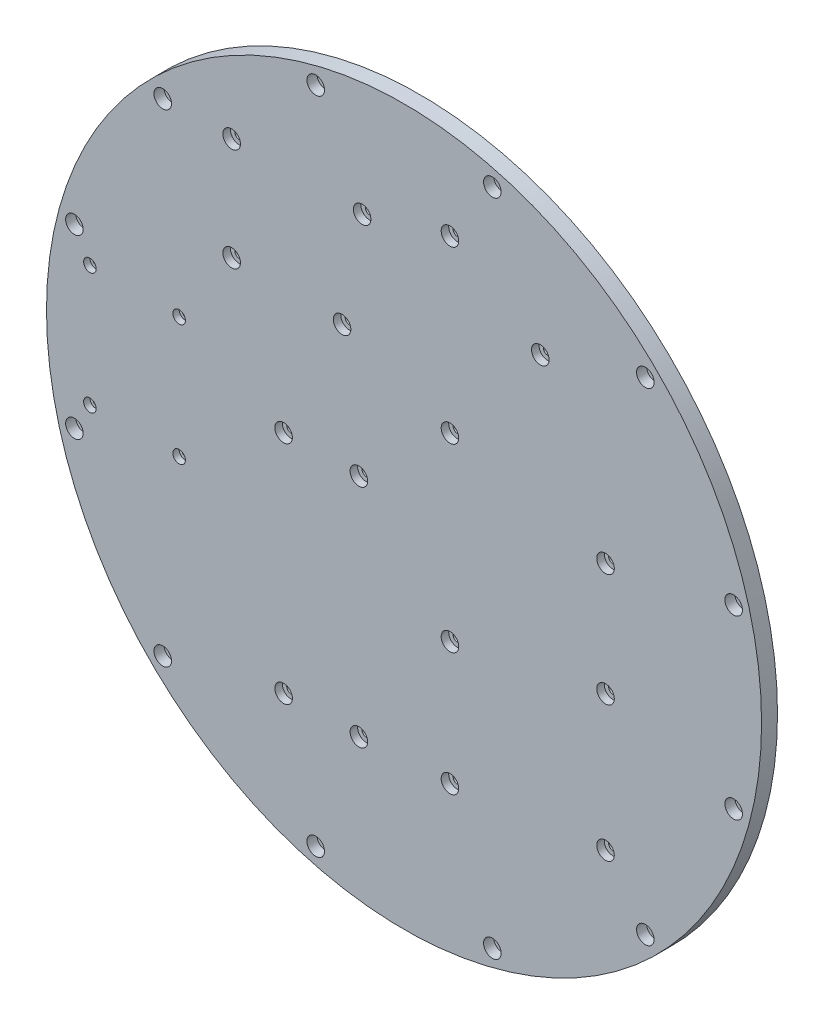
from build123d import *

# Parameters (mm, degrees)
ESQUISSE1_R              = 142.5
ESQUISSE1_R_2            = 1.75
BOSS_EXTRU_1_DEPTH       = 6.35
ESQUISSE2_R              = 3.5
ENL_V_MAT_EXTRU_1_DEPTH  = 4
ENL_V_MAT_EXTRU_2_REACH  = 203.625
ESQUISSE3_R              = 1.25
ESQUISSE4_R              = 2.5
ENL_V_MAT_EXTRU_3_DEPTH  = 2.5
ENL_V_MAT_EXTRU_4_REACH  = 203.625
ESQUISSE5_R              = 1.75
ESQUISSE6_R              = 3.5
ENL_V_MAT_EXTRU_5_DEPTH  = 3
ENL_V_MAT_EXTRU_6_REACH  = 203.625
ESQUISSE7_R              = 1.75
ESQUISSE8_R              = 3.5
ENL_V_MAT_EXTRU_7_DEPTH  = 3
ENL_V_MAT_EXTRU_8_REACH  = 203.625
ESQUISSE9_R              = 1.75
ESQUISSE10_R             = 3.5
ENL_V_MAT_EXTRU_9_DEPTH  = 3
ENL_V_MAT_EXTRU_10_REACH = 203.625
ESQUISSE11_R             = 1.75
ESQUISSE12_R             = 3.5
ENL_V_MAT_EXTRU_11_DEPTH = 3


with BuildPart() as part:
    # Esquisse1 → Boss.-Extru.1 (new body)
    with BuildSketch(Plane.XY):
        Circle(ESQUISSE1_R)
        with Locations((-35.199390134, 131.365912375)):
            Circle(ESQUISSE1_R_2, mode=Mode.SUBTRACT)
        with Locations((35.199390134, 131.365912375)):
            Circle(ESQUISSE1_R_2, mode=Mode.SUBTRACT)
        with Locations((96.166522241, 96.166522241)):
            Circle(ESQUISSE1_R_2, mode=Mode.SUBTRACT)
        with Locations((131.365912375, 35.199390134)):
            Circle(ESQUISSE1_R_2, mode=Mode.SUBTRACT)
        with Locations((131.365912375, -35.199390134)):
            Circle(ESQUISSE1_R_2, mode=Mode.SUBTRACT)
        with Locations((96.166522241, -96.166522241)):
            Circle(ESQUISSE1_R_2, mode=Mode.SUBTRACT)
        with Locations((35.199390134, -131.365912375)):
            Circle(ESQUISSE1_R_2, mode=Mode.SUBTRACT)
        with Locations((-35.199390134, -131.365912375)):
            Circle(ESQUISSE1_R_2, mode=Mode.SUBTRACT)
        with Locations((-96.166522241, -96.166522241)):
            Circle(ESQUISSE1_R_2, mode=Mode.SUBTRACT)
        with Locations((-131.365912375, -35.199390134)):
            Circle(ESQUISSE1_R_2, mode=Mode.SUBTRACT)
        with Locations((-131.365912375, 35.199390134)):
            Circle(ESQUISSE1_R_2, mode=Mode.SUBTRACT)
        with Locations((-96.166522241, 96.166522241)):
            Circle(ESQUISSE1_R_2, mode=Mode.SUBTRACT)
    extrude(amount=BOSS_EXTRU_1_DEPTH)

    # Esquisse2 → Enlèv. mat.-Extru.1 (cut)
    with BuildSketch(Plane.XY.offset(6.35)):
        with Locations((35.199390134, 131.365912375)):
            Circle(ESQUISSE2_R)
        with Locations((96.166522241, 96.166522241)):
            Circle(ESQUISSE2_R)
        with Locations((131.365912375, 35.199390134)):
            Circle(ESQUISSE2_R)
        with Locations((131.365912375, -35.199390134)):
            Circle(ESQUISSE2_R)
        with Locations((96.166522241, -96.166522241)):
            Circle(ESQUISSE2_R)
        with Locations((35.199390134, -131.365912375)):
            Circle(ESQUISSE2_R)
        with Locations((-35.199390134, -131.365912375)):
            Circle(ESQUISSE2_R)
        with Locations((-96.166522241, -96.166522241)):
            Circle(ESQUISSE2_R)
        with Locations((-131.365912375, -35.199390134)):
            Circle(ESQUISSE2_R)
        with Locations((-131.365912375, 35.199390134)):
            Circle(ESQUISSE2_R)
        with Locations((-96.166522241, 96.166522241)):
            Circle(ESQUISSE2_R)
        with Locations((-35.199390134, 131.365912375)):
            Circle(ESQUISSE2_R)
    extrude(amount=-ENL_V_MAT_EXTRU_1_DEPTH, mode=Mode.SUBTRACT)

    # Esquisse3 → Enlèv. mat.-Extru.2 (cut, up to next)
    with BuildSketch(Plane.XY.offset(6.35), mode=Mode.PRIVATE) as enl_v_mat_extru_2_sk1:
        with Locations((-125.19581902, -24.13)):
            Circle(ESQUISSE3_R)
    enl_v_mat_extru_2_tool1 = extrude(enl_v_mat_extru_2_sk1.sketch, amount=-ENL_V_MAT_EXTRU_2_REACH, mode=Mode.PRIVATE) & part.part
    # Esquisse3 → Enlèv. mat.-Extru.2 (cut, up to next)
    with BuildSketch(Plane.XY.offset(6.35), mode=Mode.PRIVATE) as enl_v_mat_extru_2_sk2:
        with Locations((-125.19581902, 24.13)):
            Circle(ESQUISSE3_R)
    enl_v_mat_extru_2_tool2 = extrude(enl_v_mat_extru_2_sk2.sketch, amount=-ENL_V_MAT_EXTRU_2_REACH, mode=Mode.PRIVATE) & part.part
    # Esquisse3 → Enlèv. mat.-Extru.2 (cut, up to next)
    with BuildSketch(Plane.XY.offset(6.35), mode=Mode.PRIVATE) as enl_v_mat_extru_2_sk3:
        with Locations((-89.63581902, 24.13)):
            Circle(ESQUISSE3_R)
    enl_v_mat_extru_2_tool3 = extrude(enl_v_mat_extru_2_sk3.sketch, amount=-ENL_V_MAT_EXTRU_2_REACH, mode=Mode.PRIVATE) & part.part
    # Esquisse3 → Enlèv. mat.-Extru.2 (cut, up to next)
    with BuildSketch(Plane.XY.offset(6.35), mode=Mode.PRIVATE) as enl_v_mat_extru_2_sk4:
        with Locations((-89.63581902, -24.13)):
            Circle(ESQUISSE3_R)
    enl_v_mat_extru_2_tool4 = extrude(enl_v_mat_extru_2_sk4.sketch, amount=-ENL_V_MAT_EXTRU_2_REACH, mode=Mode.PRIVATE) & part.part
    add(enl_v_mat_extru_2_tool1.solids().sort_by_distance((-125.195819, -24.13, 6.35))[0], mode=Mode.SUBTRACT)
    add(enl_v_mat_extru_2_tool2.solids().sort_by_distance((-125.195819, 24.13, 6.35))[0], mode=Mode.SUBTRACT)
    add(enl_v_mat_extru_2_tool3.solids().sort_by_distance((-89.635819, 24.13, 6.35))[0], mode=Mode.SUBTRACT)
    add(enl_v_mat_extru_2_tool4.solids().sort_by_distance((-89.635819, -24.13, 6.35))[0], mode=Mode.SUBTRACT)

    # Esquisse4 → Enlèv. mat.-Extru.3 (cut)
    with BuildSketch(Plane.XY.offset(6.35)):
        with Locations((-125.19581902, -24.13)):
            Circle(ESQUISSE4_R)
        with Locations((-125.19581902, 24.13)):
            Circle(ESQUISSE4_R)
        with Locations((-89.63581902, 24.13)):
            Circle(ESQUISSE4_R)
        with Locations((-89.63581902, -24.13)):
            Circle(ESQUISSE4_R)
    extrude(amount=-ENL_V_MAT_EXTRU_3_DEPTH, mode=Mode.SUBTRACT)

    # Esquisse5 → Enlèv. mat.-Extru.4 (cut, up to next)
    with BuildSketch(Plane.XY.offset(6.35), mode=Mode.PRIVATE) as enl_v_mat_extru_4_sk1:
        with Locations((-48, -85)):
            Circle(ESQUISSE5_R)
    enl_v_mat_extru_4_tool1 = extrude(enl_v_mat_extru_4_sk1.sketch, amount=-ENL_V_MAT_EXTRU_4_REACH, mode=Mode.PRIVATE) & part.part
    # Esquisse5 → Enlèv. mat.-Extru.4 (cut, up to next)
    with BuildSketch(Plane.XY.offset(6.35), mode=Mode.PRIVATE) as enl_v_mat_extru_4_sk2:
        with Locations((-48, 5)):
            Circle(ESQUISSE5_R)
    enl_v_mat_extru_4_tool2 = extrude(enl_v_mat_extru_4_sk2.sketch, amount=-ENL_V_MAT_EXTRU_4_REACH, mode=Mode.PRIVATE) & part.part
    # Esquisse5 → Enlèv. mat.-Extru.4 (cut, up to next)
    with BuildSketch(Plane.XY.offset(6.35), mode=Mode.PRIVATE) as enl_v_mat_extru_4_sk3:
        with Locations((-18, 5)):
            Circle(ESQUISSE5_R)
    enl_v_mat_extru_4_tool3 = extrude(enl_v_mat_extru_4_sk3.sketch, amount=-ENL_V_MAT_EXTRU_4_REACH, mode=Mode.PRIVATE) & part.part
    # Esquisse5 → Enlèv. mat.-Extru.4 (cut, up to next)
    with BuildSketch(Plane.XY.offset(6.35), mode=Mode.PRIVATE) as enl_v_mat_extru_4_sk4:
        with Locations((-18, -85)):
            Circle(ESQUISSE5_R)
    enl_v_mat_extru_4_tool4 = extrude(enl_v_mat_extru_4_sk4.sketch, amount=-ENL_V_MAT_EXTRU_4_REACH, mode=Mode.PRIVATE) & part.part
    add(enl_v_mat_extru_4_tool1.solids().sort_by_distance((-48, -85, 6.35))[0], mode=Mode.SUBTRACT)
    add(enl_v_mat_extru_4_tool2.solids().sort_by_distance((-48, 5, 6.35))[0], mode=Mode.SUBTRACT)
    add(enl_v_mat_extru_4_tool3.solids().sort_by_distance((-18, 5, 6.35))[0], mode=Mode.SUBTRACT)
    add(enl_v_mat_extru_4_tool4.solids().sort_by_distance((-18, -85, 6.35))[0], mode=Mode.SUBTRACT)

    # Esquisse6 → Enlèv. mat.-Extru.5 (cut)
    with BuildSketch(Plane.XY.offset(6.35)):
        with Locations((-48, -85)):
            Circle(ESQUISSE6_R)
        with Locations((-18, -85)):
            Circle(ESQUISSE6_R)
        with Locations((-48, 5)):
            Circle(ESQUISSE6_R)
        with Locations((-18, 5)):
            Circle(ESQUISSE6_R)
    extrude(amount=-ENL_V_MAT_EXTRU_5_DEPTH, mode=Mode.SUBTRACT)

    # Esquisse7 → Enlèv. mat.-Extru.6 (cut, up to next)
    with BuildSketch(Plane.XY.offset(6.35), mode=Mode.PRIVATE) as enl_v_mat_extru_6_sk1:
        with Locations((-68.7, 55)):
            Circle(ESQUISSE7_R)
    enl_v_mat_extru_6_tool1 = extrude(enl_v_mat_extru_6_sk1.sketch, amount=-ENL_V_MAT_EXTRU_6_REACH, mode=Mode.PRIVATE) & part.part
    # Esquisse7 → Enlèv. mat.-Extru.6 (cut, up to next)
    with BuildSketch(Plane.XY.offset(6.35), mode=Mode.PRIVATE) as enl_v_mat_extru_6_sk2:
        with Locations((-68.7, 96)):
            Circle(ESQUISSE7_R)
    enl_v_mat_extru_6_tool2 = extrude(enl_v_mat_extru_6_sk2.sketch, amount=-ENL_V_MAT_EXTRU_6_REACH, mode=Mode.PRIVATE) & part.part
    # Esquisse7 → Enlèv. mat.-Extru.6 (cut, up to next)
    with BuildSketch(Plane.XY.offset(6.35), mode=Mode.PRIVATE) as enl_v_mat_extru_6_sk3:
        with Locations((-24.7, 54)):
            Circle(ESQUISSE7_R)
    enl_v_mat_extru_6_tool3 = extrude(enl_v_mat_extru_6_sk3.sketch, amount=-ENL_V_MAT_EXTRU_6_REACH, mode=Mode.PRIVATE) & part.part
    # Esquisse7 → Enlèv. mat.-Extru.6 (cut, up to next)
    with BuildSketch(Plane.XY.offset(6.35), mode=Mode.PRIVATE) as enl_v_mat_extru_6_sk4:
        with Locations((-16.7, 96)):
            Circle(ESQUISSE7_R)
    enl_v_mat_extru_6_tool4 = extrude(enl_v_mat_extru_6_sk4.sketch, amount=-ENL_V_MAT_EXTRU_6_REACH, mode=Mode.PRIVATE) & part.part
    add(enl_v_mat_extru_6_tool1.solids().sort_by_distance((-68.7, 55, 6.35))[0], mode=Mode.SUBTRACT)
    add(enl_v_mat_extru_6_tool2.solids().sort_by_distance((-68.7, 96, 6.35))[0], mode=Mode.SUBTRACT)
    add(enl_v_mat_extru_6_tool3.solids().sort_by_distance((-24.7, 54, 6.35))[0], mode=Mode.SUBTRACT)
    add(enl_v_mat_extru_6_tool4.solids().sort_by_distance((-16.7, 96, 6.35))[0], mode=Mode.SUBTRACT)

    # Esquisse8 → Enlèv. mat.-Extru.7 (cut)
    with BuildSketch(Plane.XY.offset(6.35)):
        with Locations((-68.7, 55)):
            Circle(ESQUISSE8_R)
        with Locations((-68.7, 96)):
            Circle(ESQUISSE8_R)
        with Locations((-24.7, 54)):
            Circle(ESQUISSE8_R)
        with Locations((-16.7, 96)):
            Circle(ESQUISSE8_R)
    extrude(amount=-ENL_V_MAT_EXTRU_7_DEPTH, mode=Mode.SUBTRACT)

    # Esquisse9 → Enlèv. mat.-Extru.8 (cut, up to next)
    with BuildSketch(Plane(origin=(0, 0, 6.35), x_dir=(-1, 0, 0), z_dir=(0, 0, -1)), mode=Mode.PRIVATE) as enl_v_mat_extru_8_sk1:
        with Locations(Location((-18.3, 106, 0), (0, 0, 180))):
            Circle(ESQUISSE9_R)
    enl_v_mat_extru_8_tool1 = extrude(enl_v_mat_extru_8_sk1.sketch, amount=ENL_V_MAT_EXTRU_8_REACH, mode=Mode.PRIVATE) & part.part
    # Esquisse9 → Enlèv. mat.-Extru.8 (cut, up to next)
    with BuildSketch(Plane(origin=(0, 0, 6.35), x_dir=(-1, 0, 0), z_dir=(0, 0, -1)), mode=Mode.PRIVATE) as enl_v_mat_extru_8_sk2:
        with Locations(Location((-18.3, 38, 0), (0, 0, 180))):
            Circle(ESQUISSE9_R)
    enl_v_mat_extru_8_tool2 = extrude(enl_v_mat_extru_8_sk2.sketch, amount=ENL_V_MAT_EXTRU_8_REACH, mode=Mode.PRIVATE) & part.part
    # Esquisse9 → Enlèv. mat.-Extru.8 (cut, up to next)
    with BuildSketch(Plane(origin=(0, 0, 6.35), x_dir=(-1, 0, 0), z_dir=(0, 0, -1)), mode=Mode.PRIVATE) as enl_v_mat_extru_8_sk3:
        with Locations(Location((-54.3, 83, 0), (0, 0, 180))):
            Circle(ESQUISSE9_R)
    enl_v_mat_extru_8_tool3 = extrude(enl_v_mat_extru_8_sk3.sketch, amount=ENL_V_MAT_EXTRU_8_REACH, mode=Mode.PRIVATE) & part.part
    # Esquisse9 → Enlèv. mat.-Extru.8 (cut, up to next)
    with BuildSketch(Plane(origin=(0, 0, 6.35), x_dir=(-1, 0, 0), z_dir=(0, 0, -1)), mode=Mode.PRIVATE) as enl_v_mat_extru_8_sk4:
        with Locations(Location((-80.3, 24, 0), (0, 0, 180))):
            Circle(ESQUISSE9_R)
    enl_v_mat_extru_8_tool4 = extrude(enl_v_mat_extru_8_sk4.sketch, amount=ENL_V_MAT_EXTRU_8_REACH, mode=Mode.PRIVATE) & part.part
    add(enl_v_mat_extru_8_tool1.solids().sort_by_distance((18.3, 106, 6.35))[0], mode=Mode.SUBTRACT)
    add(enl_v_mat_extru_8_tool2.solids().sort_by_distance((18.3, 38, 6.35))[0], mode=Mode.SUBTRACT)
    add(enl_v_mat_extru_8_tool3.solids().sort_by_distance((54.3, 83, 6.35))[0], mode=Mode.SUBTRACT)
    add(enl_v_mat_extru_8_tool4.solids().sort_by_distance((80.3, 24, 6.35))[0], mode=Mode.SUBTRACT)

    # Esquisse10 → Enlèv. mat.-Extru.9 (cut)
    with BuildSketch(Plane.XY.offset(6.35)):
        with Locations((18.3, 38)):
            Circle(ESQUISSE10_R)
        with Locations((18.3, 106)):
            Circle(ESQUISSE10_R)
        with Locations((54.3, 83)):
            Circle(ESQUISSE10_R)
        with Locations((80.3, 24)):
            Circle(ESQUISSE10_R)
    extrude(amount=-ENL_V_MAT_EXTRU_9_DEPTH, mode=Mode.SUBTRACT)

    # Esquisse11 → Enlèv. mat.-Extru.10 (cut, up to next)
    with BuildSketch(Plane(origin=(0, 0, 6.35), x_dir=(-1, 0, 0), z_dir=(0, 0, -1)), mode=Mode.PRIVATE) as enl_v_mat_extru_10_sk1:
        with Locations(Location((-18.3, -34, 0), (0, 0, 180))):
            Circle(ESQUISSE11_R)
    enl_v_mat_extru_10_tool1 = extrude(enl_v_mat_extru_10_sk1.sketch, amount=ENL_V_MAT_EXTRU_10_REACH, mode=Mode.PRIVATE) & part.part
    # Esquisse11 → Enlèv. mat.-Extru.10 (cut, up to next)
    with BuildSketch(Plane(origin=(0, 0, 6.35), x_dir=(-1, 0, 0), z_dir=(0, 0, -1)), mode=Mode.PRIVATE) as enl_v_mat_extru_10_sk2:
        with Locations(Location((-18.3, -83, 0), (0, 0, 180))):
            Circle(ESQUISSE11_R)
    enl_v_mat_extru_10_tool2 = extrude(enl_v_mat_extru_10_sk2.sketch, amount=ENL_V_MAT_EXTRU_10_REACH, mode=Mode.PRIVATE) & part.part
    # Esquisse11 → Enlèv. mat.-Extru.10 (cut, up to next)
    with BuildSketch(Plane(origin=(0, 0, 6.35), x_dir=(-1, 0, 0), z_dir=(0, 0, -1)), mode=Mode.PRIVATE) as enl_v_mat_extru_10_sk3:
        with Locations(Location((-80.3, -21, 0), (0, 0, 180))):
            Circle(ESQUISSE11_R)
    enl_v_mat_extru_10_tool3 = extrude(enl_v_mat_extru_10_sk3.sketch, amount=ENL_V_MAT_EXTRU_10_REACH, mode=Mode.PRIVATE) & part.part
    # Esquisse11 → Enlèv. mat.-Extru.10 (cut, up to next)
    with BuildSketch(Plane(origin=(0, 0, 6.35), x_dir=(-1, 0, 0), z_dir=(0, 0, -1)), mode=Mode.PRIVATE) as enl_v_mat_extru_10_sk4:
        with Locations(Location((-80.3, -75, 0), (0, 0, 180))):
            Circle(ESQUISSE11_R)
    enl_v_mat_extru_10_tool4 = extrude(enl_v_mat_extru_10_sk4.sketch, amount=ENL_V_MAT_EXTRU_10_REACH, mode=Mode.PRIVATE) & part.part
    add(enl_v_mat_extru_10_tool1.solids().sort_by_distance((18.3, -34, 6.35))[0], mode=Mode.SUBTRACT)
    add(enl_v_mat_extru_10_tool2.solids().sort_by_distance((18.3, -83, 6.35))[0], mode=Mode.SUBTRACT)
    add(enl_v_mat_extru_10_tool3.solids().sort_by_distance((80.3, -21, 6.35))[0], mode=Mode.SUBTRACT)
    add(enl_v_mat_extru_10_tool4.solids().sort_by_distance((80.3, -75, 6.35))[0], mode=Mode.SUBTRACT)

    # Esquisse12 → Enlèv. mat.-Extru.11 (cut)
    with BuildSketch(Plane.XY.offset(6.35)):
        with Locations((18.3, -83)):
            Circle(ESQUISSE12_R)
        with Locations((18.3, -34)):
            Circle(ESQUISSE12_R)
        with Locations((80.3, -21)):
            Circle(ESQUISSE12_R)
        with Locations((80.3, -75)):
            Circle(ESQUISSE12_R)
    extrude(amount=-ENL_V_MAT_EXTRU_11_DEPTH, mode=Mode.SUBTRACT)


solid = part.part
